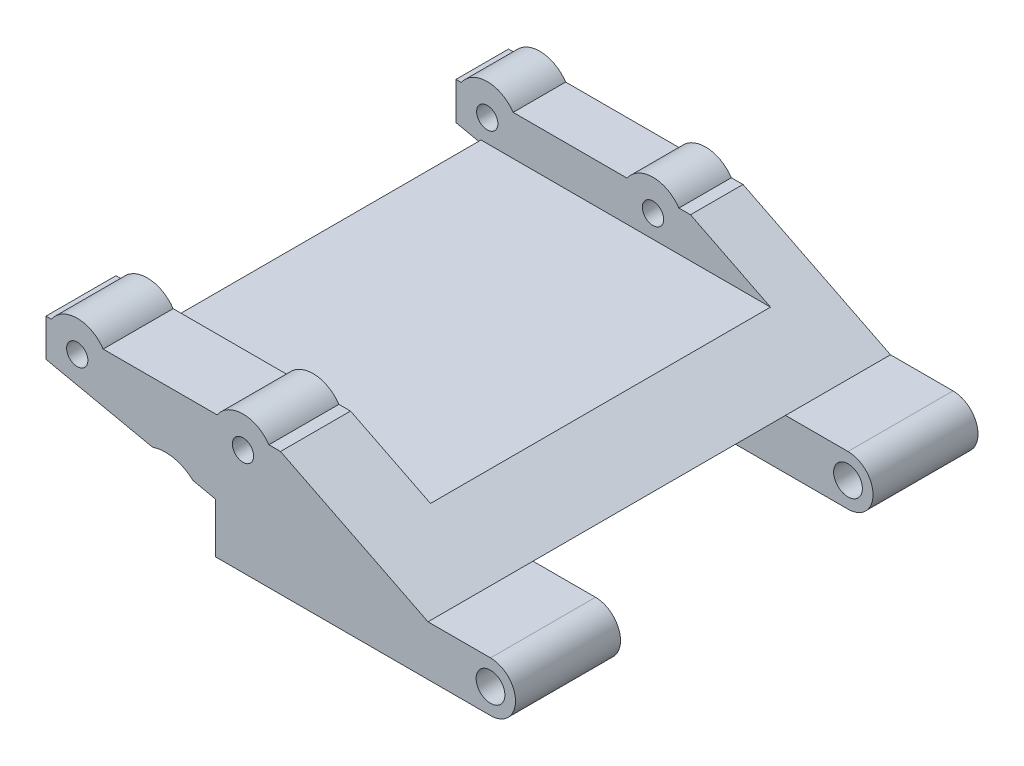
from build123d import *
from build123d.topology import SkipClean

# Parameters (mm, degrees)
EXTRUDE_1_DEPTH     = 18.5
SKETCH_2_W          = 6
SKETCH_2_H          = 5.8
SKETCH_2_H_2        = 9.4
SKETCH_2_W_2        = 12
SKETCH_2_H_3        = 20.2
CUT_EXTRUDE_1_DEPTH = 25.150569351
EXTRUDE_2_REACH     = 41.975
SKETCH_4_R          = 0.85
SKETCH_5_W          = 27.2
SKETCH_5_H          = 4.3
CUT_EXTRUDE_2_DEPTH = 43.825268242
SKETCH_6_W          = 27.2
SKETCH_6_H          = 0.5
CUT_EXTRUDE_3_DEPTH = 2


with BuildPart() as part:
    # 草图1 → 凸台-拉伸1 (new, symmetric)
    with BuildSketch(Plane.XY):
        with BuildLine():
            ThreePointArc((-11, 0), (-11.585786438, 1.414213562), (-13, 2))
            Line((-13, 2), (-13, 1.15))
            ThreePointArc((-13, 1.15), (-12.186827202, 0.813172798), (-11.85, 0))
            ThreePointArc((-11.85, 0), (-12.186827202, -0.813172798), (-13, -1.15))
            Line((-13, -1.15), (-13, -2))
            ThreePointArc((-13, -2), (-11.585786438, -1.414213562), (-11, 0))
        make_face()
        with BuildLine():
            Line((-13, 1.15), (-13, 2))
            ThreePointArc((-13, 2), (-15, 0), (-13, -2))
            Line((-13, -2), (-13, -1.15))
            ThreePointArc((-13, -1.15), (-14.15, 0), (-13, 1.15))
        make_face()
        with BuildLine():
            ThreePointArc((-11, 0), (-11.585786438, 1.414213562), (-13, 2))
            Line((-13, 2), (-13, 1.15))
            ThreePointArc((-13, 1.15), (-12.186827202, 0.813172798), (-11.85, 0))
            ThreePointArc((-11.85, 0), (-12.186827202, -0.813172798), (-13, -1.15))
            Line((-13, -1.15), (-13, -2))
            ThreePointArc((-13, -2), (-11.585786438, -1.414213562), (-11, 0))
        make_face()
        with BuildLine():
            Line((-13, 1.15), (-13, 2))
            ThreePointArc((-13, 2), (-15, 0), (-13, -2))
            Line((-13, -2), (-13, -1.15))
            ThreePointArc((-13, -1.15), (-14.15, 0), (-13, 1.15))
        make_face()
        with BuildLine():
            Line((13, 2), (-13, 2))
            ThreePointArc((-13, 2), (-11.585786438, 1.414213562), (-11, 0))
            ThreePointArc((-11, 0), (-11.585786438, -1.414213562), (-13, -2))
            Line((-13, -2), (13, -2))
            ThreePointArc((13, -2), (11, 0), (13, 2))
        make_face()
        with BuildLine():
            ThreePointArc((15, 0), (14.414213562, 1.414213562), (13, 2))
            Line((13, 2), (13, 1.15))
            ThreePointArc((13, 1.15), (13.813172798, 0.813172798), (14.15, 0))
            ThreePointArc((14.15, 0), (13.813172798, -0.813172798), (13, -1.15))
            Line((13, -1.15), (13, -2))
            ThreePointArc((13, -2), (14.414213562, -1.414213562), (15, 0))
        make_face()
        with BuildLine():
            Line((13, 1.15), (13, 2))
            ThreePointArc((13, 2), (11, 0), (13, -2))
            Line((13, -2), (13, -1.15))
            ThreePointArc((13, -1.15), (11.85, 0), (13, 1.15))
        make_face()
        with BuildLine():
            ThreePointArc((15, 0), (14.414213562, 1.414213562), (13, 2))
            Line((13, 2), (13, 1.15))
            ThreePointArc((13, 1.15), (13.813172798, 0.813172798), (14.15, 0))
            ThreePointArc((14.15, 0), (13.813172798, -0.813172798), (13, -1.15))
            Line((13, -1.15), (13, -2))
            ThreePointArc((13, -2), (14.414213562, -1.414213562), (15, 0))
        make_face()
        with BuildLine():
            Line((13, 1.15), (13, 2))
            ThreePointArc((13, 2), (11, 0), (13, -2))
            Line((13, -2), (13, -1.15))
            ThreePointArc((13, -1.15), (11.85, 0), (13, 1.15))
        make_face()
    extrude(amount=EXTRUDE_1_DEPTH, both=True)

    # 草图2 → 切除-拉伸1 (cut, through all)
    with SkipClean():  # the faces are left unmerged after this step: merging them gives an invalid solid
        with BuildSketch(Plane(origin=(0, 2, 0), x_dir=(1, 0, 0), z_dir=(0, 1, 0))):
            with Locations((-12, 0)):
                Rectangle(SKETCH_2_W, SKETCH_2_H)
            with Locations((-12, -13.8)):
                Rectangle(SKETCH_2_W, SKETCH_2_H_2)
            with Locations((-12, 13.8)):
                Rectangle(SKETCH_2_W, SKETCH_2_H_2)
            with Locations((9, 0)):
                Rectangle(SKETCH_2_W_2, SKETCH_2_H_3)
        extrude(amount=-CUT_EXTRUDE_1_DEPTH, mode=Mode.SUBTRACT)

    # 凸台-拉伸2: up to this face of the body (flat: up to its plane)
    extrude_2_end = Plane(part.part.faces().sort_by_distance((2.318945453, 0, -18.5))[0])
    # 草图4 → 凸台-拉伸2 (add, up to the picked face)
    with BuildSketch(Plane.XY.offset(18.5), mode=Mode.PRIVATE) as extrude_2_sk1:
        with BuildLine():
            Line((-10.789828689, 2.382780472), (-9, 2))
            Line((-9, 2), (8, 2))
            Line((8, 2), (-3.8, 7.9))
            Line((-3.8, 7.9), (-4.728768482, 7.9))
            ThreePointArc((-4.728768482, 7.9), (-6.8, 9), (-8.871231518, 7.9))
            Line((-8.871231518, 7.9), (-17.988768482, 7.9))
            ThreePointArc((-17.988768482, 7.9), (-20.06, 9), (-22.131231518, 7.9))
            Line((-22.131231518, 7.9), (-22.56, 7.9))
            Line((-22.56, 7.9), (-22.56, 4.9))
            Line((-22.56, 4.9), (-14.042229791, 3.078352979))
            ThreePointArc((-14.042229791, 3.078352979), (-12.320311008, 3.178131979), (-10.789828689, 2.382780472))
        make_face()
        with Locations((-20.06, 6.5)):
            Circle(SKETCH_4_R, mode=Mode.SUBTRACT)
        with Locations((-6.8, 6.5)):
            Circle(SKETCH_4_R, mode=Mode.SUBTRACT)
    extrude_2_tool1 = split(extrude(extrude_2_sk1.sketch, amount=-EXTRUDE_2_REACH, mode=Mode.PRIVATE), bisect_by=extrude_2_end, keep=Keep.BOTH, mode=Mode.PRIVATE)
    add(extrude_2_tool1.solids().sort_by(Axis((-8.777143, 5.120579, 18.5), (0, 0, -1)))[0])

    # 草图5 → 切除-拉伸2 (cut, through all)
    with SkipClean():  # the faces are left unmerged after this step: merging them gives an invalid solid
        with BuildSketch(Plane.ZY.offset(22.56)):
            with Locations((-0.7, 6.85)):
                Rectangle(SKETCH_5_W, SKETCH_5_H)
        extrude(amount=-CUT_EXTRUDE_2_DEPTH, mode=Mode.SUBTRACT)

    # 草图6 → 切除-拉伸3 (cut)
    with SkipClean():  # the faces are left unmerged after this step: merging them gives an invalid solid
        with BuildSketch(Plane.ZY.offset(22.56)):
            with Locations((-0.7, 4.7)):
                Rectangle(SKETCH_6_W, SKETCH_6_H)
        extrude(amount=-CUT_EXTRUDE_3_DEPTH, mode=Mode.SUBTRACT)


solid = part.part
